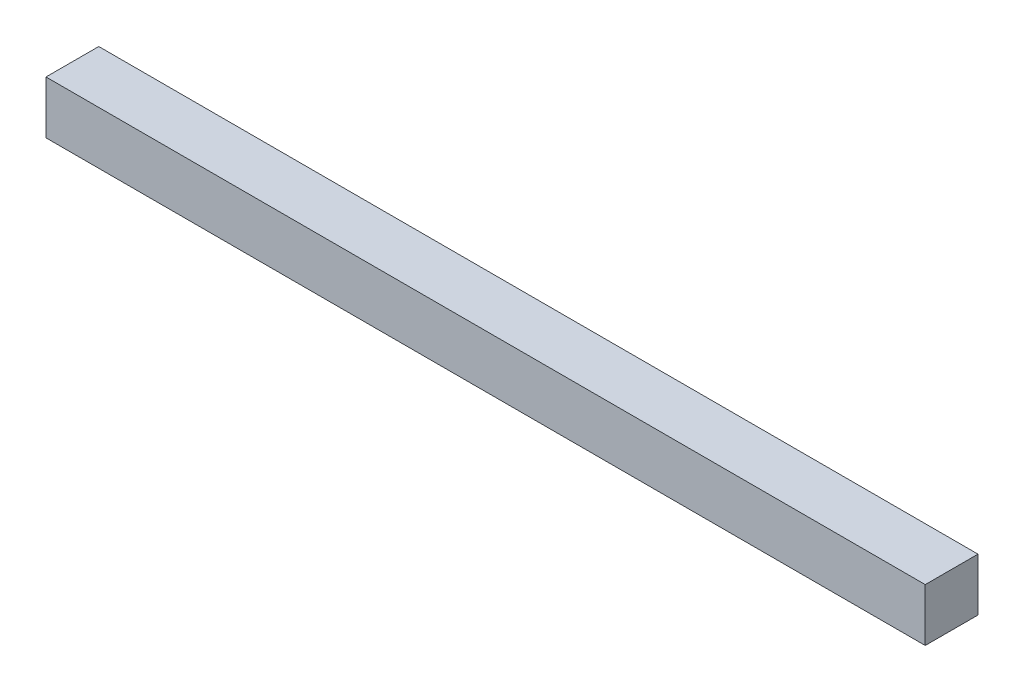
from build123d import *

# Parameters (mm, degrees)
SKETCH1_W           = 30
SKETCH1_H           = 30
BOSS_EXTRUDE1_DEPTH = 500


with BuildPart() as part:
    # Sketch1 → Boss-Extrude1 (new body)
    with BuildSketch(Plane(origin=(0, 0, 0), x_dir=(0, 0, -1), z_dir=(1, 0, 0))):
        with Locations((5.395911414, 6.963475298)):
            Rectangle(SKETCH1_W, SKETCH1_H)
    extrude(amount=BOSS_EXTRUDE1_DEPTH)


solid = part.part
